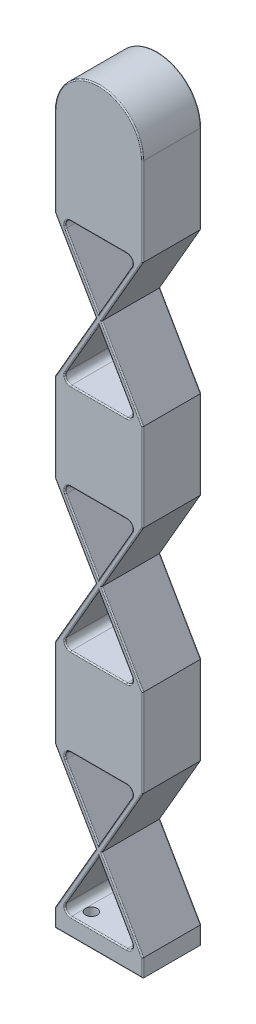
from build123d import *

# Parameters (mm, degrees)
SKETCH1_W                   = 15
SKETCH1_H                   = 15
BOSS_EXTRUDE1_DEPTH         = 5
BOSS_EXTRUDE2_START         = 5
BOSS_EXTRUDE2_DEPTH         = 10
BOSS_EXTRUDE3_START         = -5
BOSS_EXTRUDE3_DEPTH         = 10
SKETCH1_5_W                 = 15
SKETCH1_5_H                 = 15
BOSS_EXTRUDE4_DEPTH         = 5
BOSS_EXTRUDE5_DEPTH         = 10
SKETCH36_W                  = 15
SKETCH36_H                  = 10
CUT_EXTRUDE1_DEPTH          = 129.56251734
FILLET1_R                   = 1
F_2_0_MM_DOWEL_HOLES1_D     = 2
F_2_0_MM_DOWEL_HOLES1_DEPTH = 3
FILLET2_R                   = 0.2


with BuildPart() as part:
    # Sketch1 → Boss-Extrude1 (new, symmetric)
    with BuildSketch(Plane.XY):
        with Locations((0, -19.624355653)):
            Rectangle(SKETCH1_W, SKETCH1_H)
    boss_extrude1 = extrude(amount=BOSS_EXTRUDE1_DEPTH, both=True)

    # Sketch1<3> → Boss-Extrude2 (add)
    with BuildSketch(Plane.XY.offset(BOSS_EXTRUDE2_START)):
        Polygon((-6.5, -12.124355653), (0, -0.866025404), (-0.5, 0), (-7.5, -12.124355653), align=None)
        Polygon((0.5, 0), (7.5, 12.124355653), (6.5, 12.124355653), (0, 0.866025404), align=None)
        Polygon((0, -0.866025404), (0.5, 0), (0, 0.866025404), (-0.5, 0), align=None)
    boss_extrude2 = extrude(amount=-BOSS_EXTRUDE2_DEPTH)

    # Sketch1<4> → Boss-Extrude3 (add)
    with BuildSketch(Plane.XY.offset(BOSS_EXTRUDE3_START)):
        Polygon((0, 0.866025404), (-6.5, 12.124355653), (-7.5, 12.124355653), (-0.5, 0), align=None)
        Polygon((7.5, -12.124355653), (0.5, 0), (0, -0.866025404), (6.5, -12.124355653), align=None)
        Polygon((0, -0.866025404), (0.5, 0), (0, 0.866025404), (-0.5, 0), align=None)
    boss_extrude3 = extrude(amount=BOSS_EXTRUDE3_DEPTH)

    # Sketch1<5> → Boss-Extrude4 (add, symmetric)
    with BuildSketch(Plane.XY):
        with Locations((0, 19.624355653)):
            Rectangle(SKETCH1_5_W, SKETCH1_5_H)
    boss_extrude4 = extrude(amount=BOSS_EXTRUDE4_DEPTH, both=True)

    # Mirror2: Boss-Extrude2, Boss-Extrude3 across plane
    add(boss_extrude2.mirror(Plane(origin=(0, 19.624355653, 0), x_dir=(0, 0, 1), z_dir=(0, -1, 0))))
    add(boss_extrude3.mirror(Plane(origin=(0, 19.624355653, 0), x_dir=(0, 0, 1), z_dir=(0, -1, 0))))

    # Mirror3: Boss-Extrude1 across plane
    add(boss_extrude1.mirror(Plane(origin=(0, 19.624355653, 0), x_dir=(0, 0, 1), z_dir=(0, -1, 0))))

    # Mirror4: Boss-Extrude2 across plane
    add(boss_extrude2.mirror(Plane.ZX.offset(-19.624355653)))

    # Mirror5: Boss-Extrude3 across plane
    add(boss_extrude3.mirror(Plane.ZX.offset(-19.624355653)))

    # Mirror6: Boss-Extrude4 across plane
    add(boss_extrude4.mirror(Plane.ZX.offset(-19.624355653)))

    # Sketch29 → Boss-Extrude5 (add)
    with BuildSketch(Plane.XY.offset(5)):
        with BuildLine():
            ThreePointArc((-7.5, 66.373066959), (0, 73.873066959), (7.5, 66.373066959))
            Line((7.5, 66.373066959), (-7.5, 66.373066959))
        make_face()
    extrude(amount=-BOSS_EXTRUDE5_DEPTH)

    # Sketch36 → Cut-Extrude1 (cut, through all)
    with BuildSketch(Plane(origin=(0, -54.373066959, 0), x_dir=(1, 0, 0), z_dir=(0, 1, 0))):
        Rectangle(SKETCH36_W, SKETCH36_H)
    extrude(amount=-CUT_EXTRUDE1_DEPTH, mode=Mode.SUBTRACT)

    # Fillet1
    fillet1_edges = [part.edges().sort_by_distance(p)[0] for p in [
        (-6.5, 27.124355653, 0),
        (6.5, 51.373066959, 0),
        (6.5, -51.373066959, 0),
        (-6.5, -27.124355653, 0),
        (-6.5, -51.373066959, 0),
        (6.5, -27.124355653, 0),
        (6.5, 12.124355653, 0),
        (-6.5, -12.124355653, 0),
        (6.5, -12.124355653, 0),
        (-6.5, 12.124355653, 0),
        (6.5, 27.124355653, 0),
        (-6.5, 51.373066959, 0),
    ]]
    fillet(fillet1_edges, radius=FILLET1_R)

    # Ø2.0 mm Dowel Holes1
    with Locations(Plane(origin=(0, -51.373066959, 0), x_dir=(1, 0, 0), z_dir=(0, 1, 0))):
        with Locations((3.75, 2.5), (-3.75, -2.5)):
            Hole(F_2_0_MM_DOWEL_HOLES1_D / 2, depth=F_2_0_MM_DOWEL_HOLES1_DEPTH)

    # Fillet2
    fillet2_edges = [part.edges().sort_by_distance(p)[0] for p in [
        (-2.816987298, 33.503520778, -5),
        (-4, 33.186533479, -5),
        (2.816987298, 44.993901834, -5),
        (4, 45.310889132, -5),
        (-2.816987298, 33.503520778, 5),
        (4, 45.310889132, 5),
        (-4, 33.186533479, 5),
        (2.816987298, 44.993901834, 5),
        (-7.5, 58.873066959, -5),
        (7.5, 58.873066959, 5),
        (-7.5, 58.873066959, 5),
        (7.5, 58.873066959, -5),
        (-4, -33.186533479, -5),
        (4, -45.310889132, -5),
        (-2.816987298, -33.503520778, -5),
        (4, -45.310889132, 5),
        (2.816987298, -44.993901834, -5),
        (-4, -33.186533479, 5),
        (7.5, -19.624355653, 5),
        (-2.816987298, -44.993901834, -5),
        (-4, -45.310889132, -5),
        (2.816987298, -33.503520778, -5),
        (4, -33.186533479, -5),
        (-2.816987298, -44.993901834, 5),
        (4, -33.186533479, 5),
        (-4, -45.310889132, 5),
        (2.816987298, -33.503520778, 5),
        (4, 6.062177826, -5),
        (-4, -6.062177826, -5),
        (0, 73.873066959, -5),
        (0, 73.873066959, 5),
        (-7.5, -52.873066959, -5),
        (-7.5, -52.873066959, 5),
        (7.5, -52.873066959, -5),
        (7.5, -52.873066959, 5),
        (0, -54.373066959, 5),
        (0, -54.373066959, -5),
        (0, -51.373066959, 5),
        (0, -51.373066959, -5),
        (2.816987298, -44.993901834, 5),
        (0, -27.124355653, 5),
        (0, -27.124355653, -5),
        (-2.816987298, -33.503520778, 5),
        (0, -12.124355653, -5),
        (0, -12.124355653, 5),
        (-2.816987298, -5.745190528, 5),
        (0, 12.124355653, -5),
        (0, 12.124355653, 5),
        (2.816987298, 5.745190528, 5),
        (0, 51.373066959, -5),
        (0, 51.373066959, 5),
        (-2.816987298, 44.993901834, 5),
        (2.816987298, 33.503520778, 5),
        (0, 27.124355653, -5),
        (0, 27.124355653, 5),
        (-5.633974596, -50.873066959, -5),
        (-5.633974596, -50.873066959, 5),
        (5.633974596, -50.873066959, 5),
        (5.633974596, -50.873066959, -5),
        (5.633974596, -27.624355653, -5),
        (5.633974596, -27.624355653, 5),
        (-5.633974596, -27.624355653, 5),
        (-5.633974596, -27.624355653, -5),
        (-5.633974596, -11.624355653, 5),
        (-5.633974596, -11.624355653, -5),
        (2.816987298, 5.745190528, -5),
        (5.633974596, -11.624355653, -5),
        (5.633974596, -11.624355653, 5),
        (-4, -6.062177826, 5),
        (-5.633974596, 11.624355653, -5),
        (-5.633974596, 11.624355653, 5),
        (5.633974596, 11.624355653, 5),
        (5.633974596, 11.624355653, -5),
        (5.633974596, 50.873066959, -5),
        (5.633974596, 50.873066959, 5),
        (-5.633974596, 50.873066959, 5),
        (-5.633974596, 50.873066959, -5),
        (5.633974596, 27.624355653, 5),
        (-2.816987298, -5.745190528, -5),
        (5.633974596, 27.624355653, -5),
        (-5.633974596, 27.624355653, -5),
        (-5.633974596, 27.624355653, 5),
        (4, 6.062177826, 5),
        (2.816987298, -5.745190528, -5),
        (4, -6.062177826, -5),
        (4, -6.062177826, 5),
        (2.816987298, -5.745190528, 5),
        (-4, 6.062177826, -5),
        (-2.816987298, 5.745190528, -5),
        (-4, 6.062177826, 5),
        (-2.816987298, 5.745190528, 5),
        (-7.5, -19.624355653, 5),
        (7.5, 19.624355653, 5),
        (-7.5, 19.624355653, -5),
        (-7.5, 19.624355653, 5),
        (7.5, 19.624355653, -5),
        (7.5, -19.624355653, -5),
        (-7.5, -19.624355653, -5),
        (-4, 45.310889132, -5),
        (4, 33.186533479, -5),
        (-2.816987298, 44.993901834, -5),
        (4, 33.186533479, 5),
        (2.816987298, 33.503520778, -5),
        (-4, 45.310889132, 5),
    ]]
    fillet(fillet2_edges, radius=FILLET2_R)


solid = part.part
